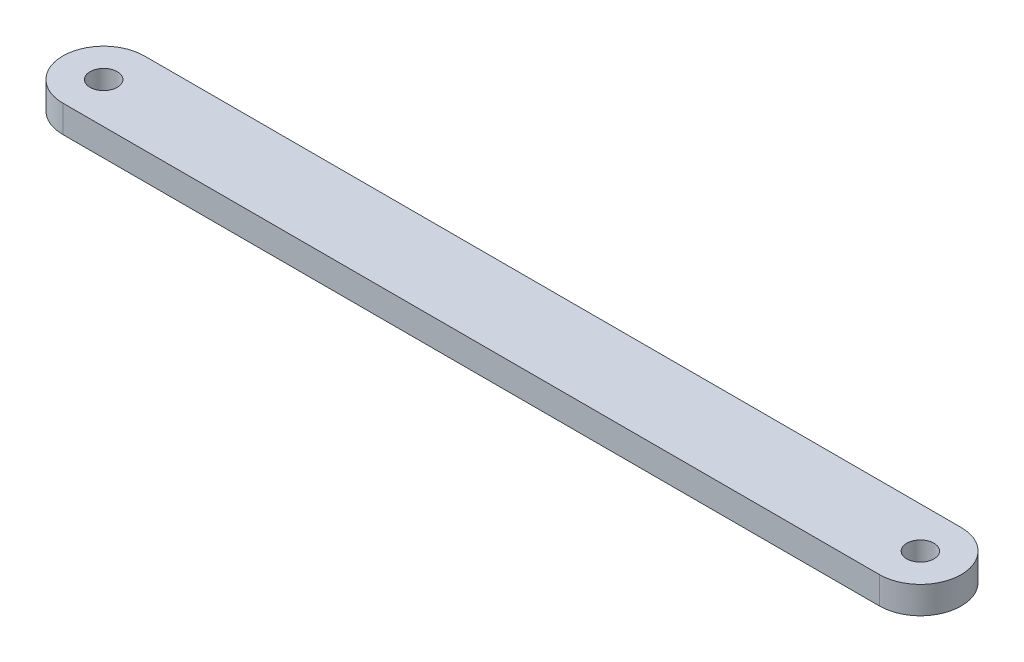
from build123d import *

# Parameters (mm, degrees)
SKETCH1_R           = 2.5
BOSS_EXTRUDE1_DEPTH = 5


with BuildPart() as part:
    # Sketch1 → Boss-Extrude1 (new body)
    with BuildSketch(Plane(origin=(0, 0, 0), x_dir=(1, 0, 0), z_dir=(0, 1, 0))):
        with BuildLine():
            Line((-75, 7.5), (75, 7.5))
            ThreePointArc((75, 7.5), (82.5, 0), (75, -7.5))
            Line((75, -7.5), (-75, -7.5))
            ThreePointArc((-75, -7.5), (-82.5, 0), (-75, 7.5))
        make_face()
        with Locations(Location((-75, 0, 0), (0, 0, 270))):
            Circle(SKETCH1_R, mode=Mode.SUBTRACT)
        with Locations(Location((75, 0, 0), (0, 0, 270))):
            Circle(SKETCH1_R, mode=Mode.SUBTRACT)
    extrude(amount=BOSS_EXTRUDE1_DEPTH)


solid = part.part
